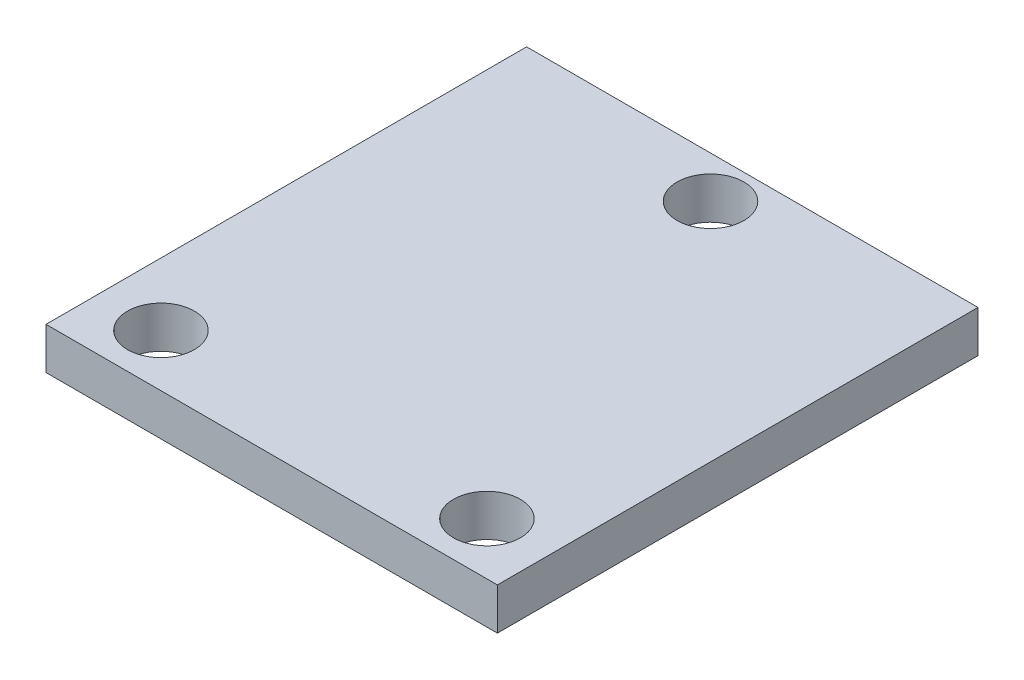
from build123d import *

# Parameters (mm, degrees)
SKETCH_1_W      = 10.8
SKETCH_1_H      = 11.5
SKETCH_1_R      = 0.8
EXTRUDE_1_DEPTH = 1


with BuildPart() as part:
    # 草图1 → 凸台-拉伸1 (new body)
    with BuildSketch(Plane(origin=(0, 0, 0), x_dir=(1, 0, 0), z_dir=(0, 1, 0))):
        with Locations((5.4, -5.75)):
            Rectangle(SKETCH_1_W, SKETCH_1_H)
        with Locations(Location((5.4, -1, 0), (0, 0, 270))):
            Circle(SKETCH_1_R, mode=Mode.SUBTRACT)
        with Locations(Location((9.3, -10.25, 0), (0, 0, 270))):
            Circle(SKETCH_1_R, mode=Mode.SUBTRACT)
        with Locations(Location((1.5, -10.25, 0), (0, 0, 270))):
            Circle(SKETCH_1_R, mode=Mode.SUBTRACT)
    extrude(amount=EXTRUDE_1_DEPTH)


solid = part.part
